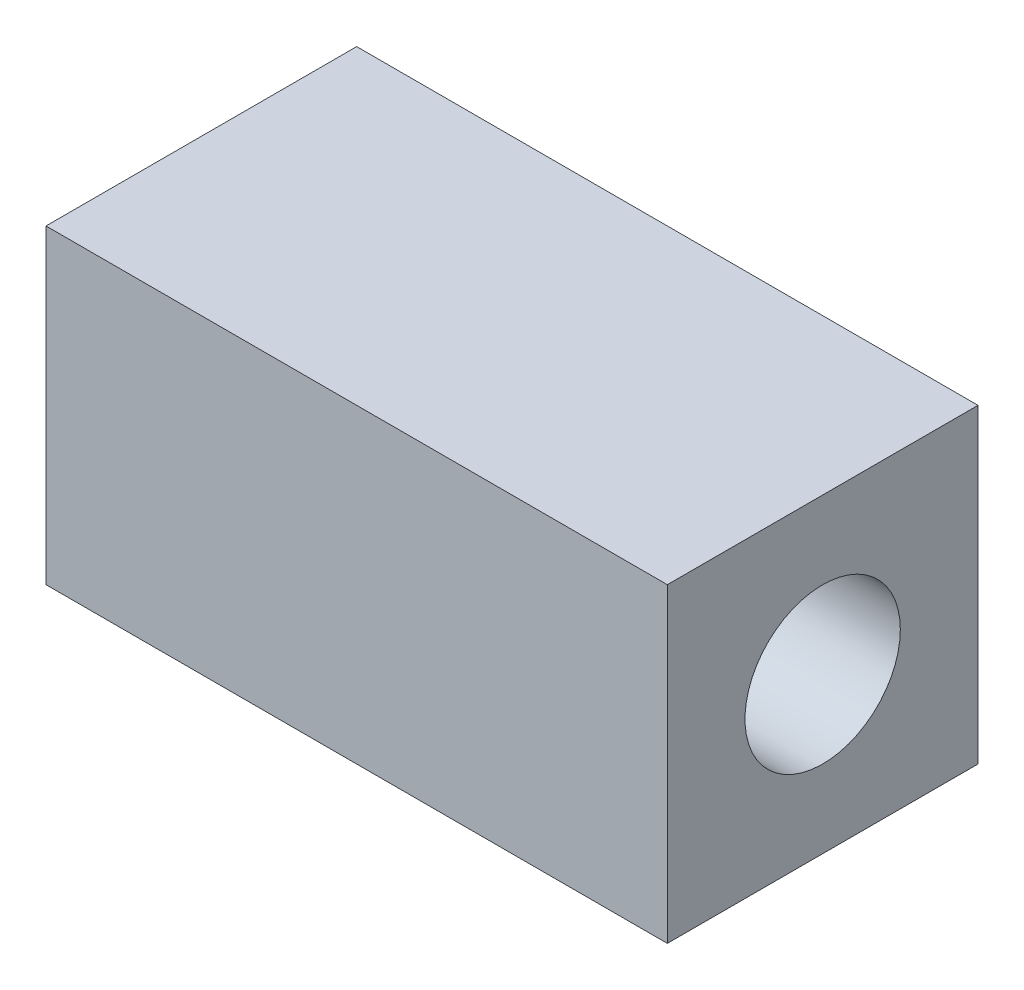
from build123d import *

# Parameters (mm, degrees)
CROQUIS1_W              = 20
CROQUIS1_H              = 20
CROQUIS1_R              = 5
SALIENTE_EXTRUIR1_DEPTH = 40


with BuildPart() as part:
    # Croquis1 → Saliente-Extruir1 (new body)
    with BuildSketch(Plane(origin=(0, 0, 0), x_dir=(0, 0, -1), z_dir=(1, 0, 0))):
        with Locations((10, 10)):
            Rectangle(CROQUIS1_W, CROQUIS1_H)
        with Locations((10, 10)):
            Circle(CROQUIS1_R, mode=Mode.SUBTRACT)
    extrude(amount=SALIENTE_EXTRUIR1_DEPTH)


solid = part.part
